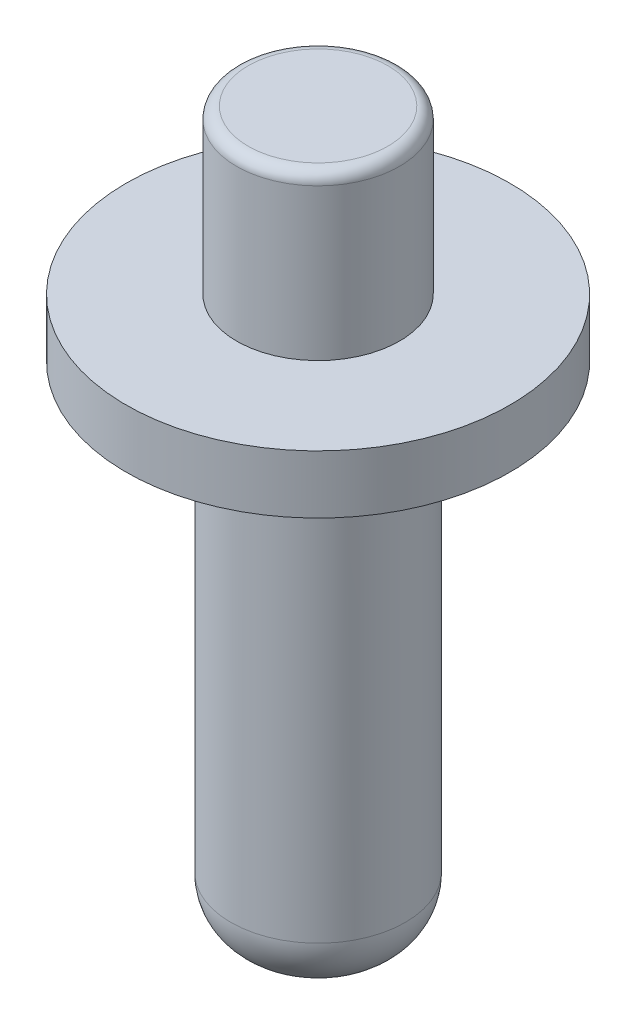
from build123d import *

# Parameters (mm, degrees)
FILLET_1_R = 0.1
FILLET_2_R = 0.5


with BuildPart() as part:
    # 草图1 → 旋转1 (revolve)
    with BuildSketch(Plane.XY):
        Polygon((0, -4.3), (-0.75, -4.3), (-0.75, 0), (-1.65, 0), (-1.65, 0.5), (-0.7, 0.5), (-0.7, 1.9), (0, 1.9), align=None)
    revolve(axis=Axis((0, 12.887242456, 0), (0, -1, 0)))

    # 圆角1
    fillet_1_edges = [part.edges().sort_by_distance(p)[0] for p in [
        (0.7, 1.9, 0),
    ]]
    fillet(fillet_1_edges, radius=FILLET_1_R)

    # 圆角2
    fillet_2_edges = [part.edges().sort_by_distance(p)[0] for p in [
        (0.75, -4.3, 0),
    ]]
    fillet(fillet_2_edges, radius=FILLET_2_R)


solid = part.part
